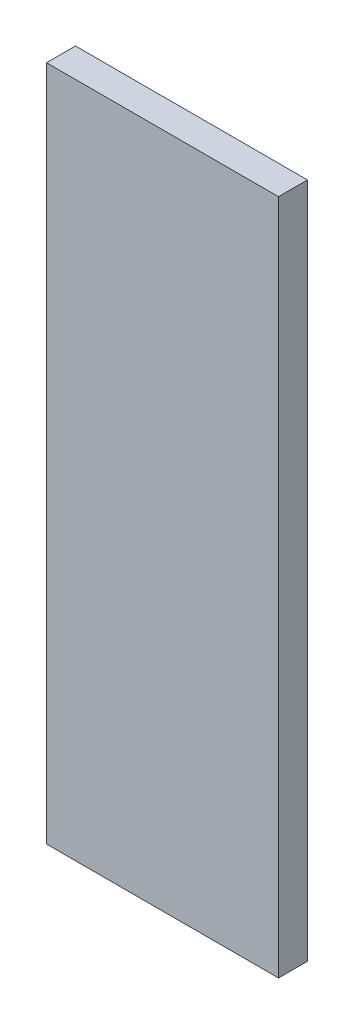
from build123d import *

# Parameters (mm, degrees)
CROQUIS1_W              = 24
CROQUIS1_H              = 70
SALIENTE_EXTRUIR1_DEPTH = 3


with BuildPart() as part:
    # Croquis1 → Saliente-Extruir1 (new body)
    with BuildSketch(Plane.XY):
        Rectangle(CROQUIS1_W, CROQUIS1_H)
    extrude(amount=SALIENTE_EXTRUIR1_DEPTH)


solid = part.part
